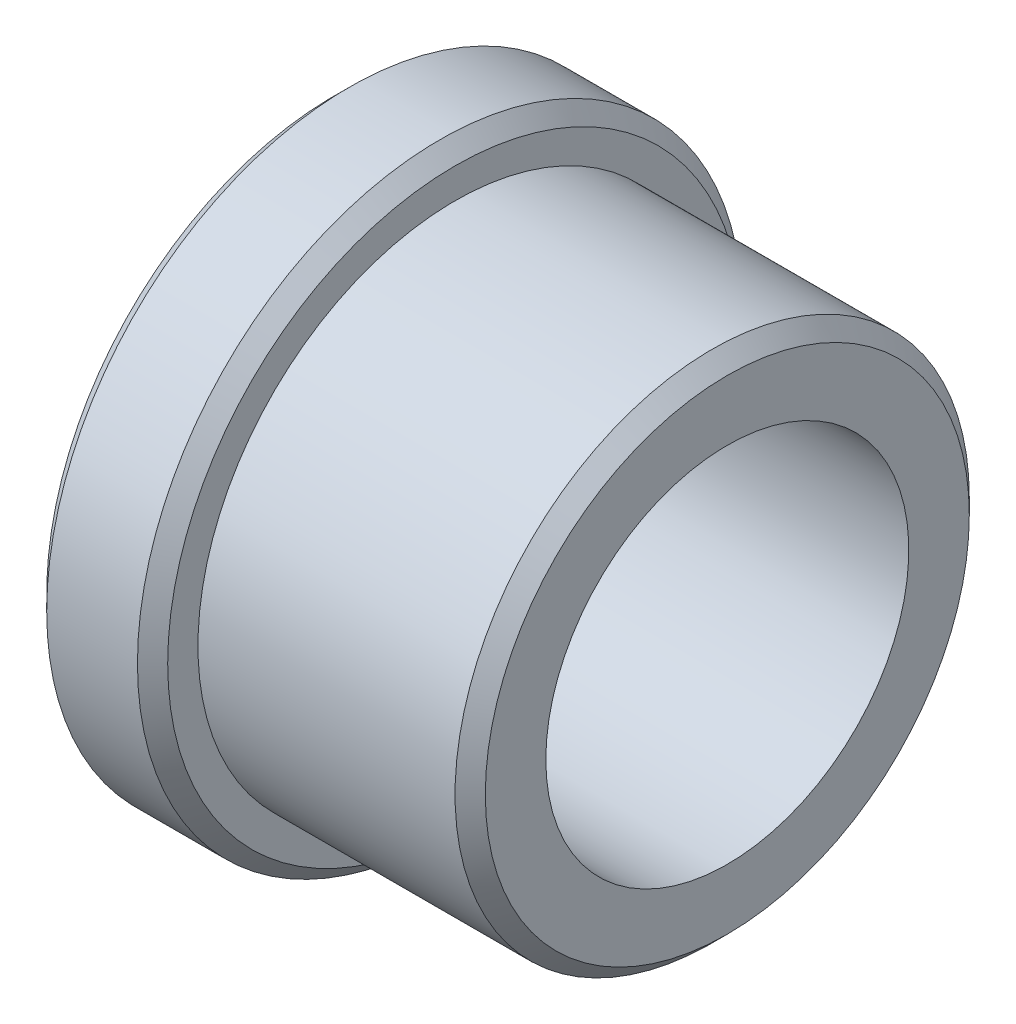
from build123d import *

# Parameters (mm, degrees)
SKETCH_1_R          = 10
SKETCH_1_R_2        = 6
EXTRUDE_2_DEPTH     = 13
SKETCH_2_OUTSIDE_W  = 28.226
SKETCH_2_OUTSIDE_H  = 28.226
SKETCH_2_OUTSIDE_R  = 8.5
CUT_EXTRUDE_1_DEPTH = 9
CHAMFER_1_SIZE      = 0.5


with BuildPart() as part:
    # 草图1 → 凸台-拉伸2 (new body)
    with BuildSketch(Plane(origin=(0, 0, 0), x_dir=(0, 0, -1), z_dir=(1, 0, 0))):
        with Locations(Location((0, 0, 0), (0, 0, 180))):
            Circle(SKETCH_1_R)
        with Locations(Location((0, 0, 0), (0, 0, 180))):
            Circle(SKETCH_1_R_2, mode=Mode.SUBTRACT)
    extrude(amount=EXTRUDE_2_DEPTH)

    # 草图2 outside → 切除-拉伸1 (cut)
    with BuildSketch(Plane(origin=(13, 0, 0), x_dir=(0, 0, -1), z_dir=(1, 0, 0))):
        Rectangle(SKETCH_2_OUTSIDE_W, SKETCH_2_OUTSIDE_H)
        Circle(SKETCH_2_OUTSIDE_R, mode=Mode.SUBTRACT)
    extrude(amount=-CUT_EXTRUDE_1_DEPTH, mode=Mode.SUBTRACT)

    # 倒角1
    chamfer_1_edges = [part.edges().sort_by_distance(p)[0] for p in [
        (4, 0, -10),
        (13, 0, 8.5),
        (0, 0, -10),
        (0, 0, -6),
    ]]
    chamfer(chamfer_1_edges, length=CHAMFER_1_SIZE)


solid = part.part
